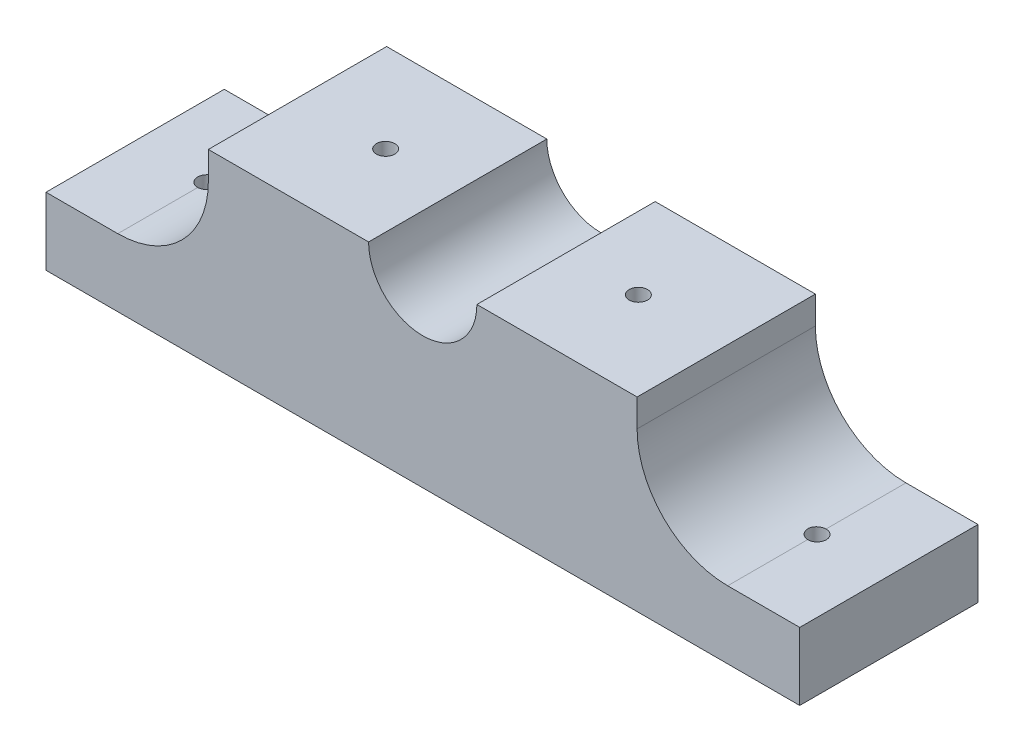
from build123d import *

# Parameters (mm, degrees)
SKETCH2_W               = 41.746000074
SKETCH2_H               = 9.873000066
BOSS_EXTRUDE1_DEPTH     = 3.746000128
SKETCH3_W               = 23.746000006
SKETCH3_H               = 9.873000066
BOSS_EXTRUDE2_DEPTH     = 6.548499984
FILLET1_R               = 5.0165
SKETCH4_R               = 2.99974
CUT_EXTRUDE1_DEPTH      = 26.281119307
CUT_EXTRUDE2_DEPTH      = 23.426190384
CUT_EXTRUDE2_DEPTH_BACK = 2.54
SKETCH6_R               = 0.508
SKETCH7_R               = 0.508
CUT_EXTRUDE3_DEPTH      = 2.54


with BuildPart() as part:
    # Sketch2 → Boss-Extrude1 (new body)
    with BuildSketch(Plane(origin=(0, 0, 0), x_dir=(1, 0, 0), z_dir=(0, 1, 0))):
        Rectangle(SKETCH2_W, SKETCH2_H)
    extrude(amount=BOSS_EXTRUDE1_DEPTH)

    # Sketch3 → Boss-Extrude2 (add)
    with BuildSketch(Plane(origin=(0, 3.746000128, 0), x_dir=(1, 0, 0), z_dir=(0, 1, 0))):
        with Locations((-0.00733485, 0)):
            Rectangle(SKETCH3_W, SKETCH3_H)
    extrude(amount=BOSS_EXTRUDE2_DEPTH)

    # Fillet1
    fillet1_edges = [part.edges().sort_by_distance(p)[0] for p in [
        (-11.880334853, 3.746000128, 0),
        (11.865665153, 3.746000128, 0),
    ]]
    fillet(fillet1_edges, radius=FILLET1_R)

    # Sketch4 → Cut-Extrude1 (cut, through all)
    with BuildSketch(Plane.XY.offset(4.936500033)):
        with Locations((-0.00733485, 10.294500112)):
            Circle(SKETCH4_R)
    extrude(amount=-CUT_EXTRUDE1_DEPTH, mode=Mode.SUBTRACT)

    # Sketch6 → Cut-Extrude2 (cut, two sides: drawn at the far end of the back side and taken through both)
    with BuildSketch(Plane(origin=(0, 3.746000128, 0), x_dir=(1, 0, 0), z_dir=(0, 1, 0)).offset(-CUT_EXTRUDE2_DEPTH_BACK)):
        with Locations(Location((-16.896834853, 0, 0), (0, 0, 270))):
            Circle(SKETCH6_R)
        with Locations(Location((16.896834853, 0, 0), (0, 0, 90))):
            Circle(SKETCH6_R)
    extrude(amount=CUT_EXTRUDE2_DEPTH + CUT_EXTRUDE2_DEPTH_BACK, mode=Mode.SUBTRACT)

    # Sketch7 → Cut-Extrude3 (cut)
    with BuildSketch(Plane(origin=(0, 10.294500112, 0), x_dir=(1, 0, 0), z_dir=(0, 1, 0))):
        with Locations(Location((-6.99999997, 0, 0), (0, 0, 270))):
            Circle(SKETCH7_R)
        with Locations(Location((6.99999997, 0, 0), (0, 0, 90))):
            Circle(SKETCH7_R)
    extrude(amount=-CUT_EXTRUDE3_DEPTH, mode=Mode.SUBTRACT)


solid = part.part
